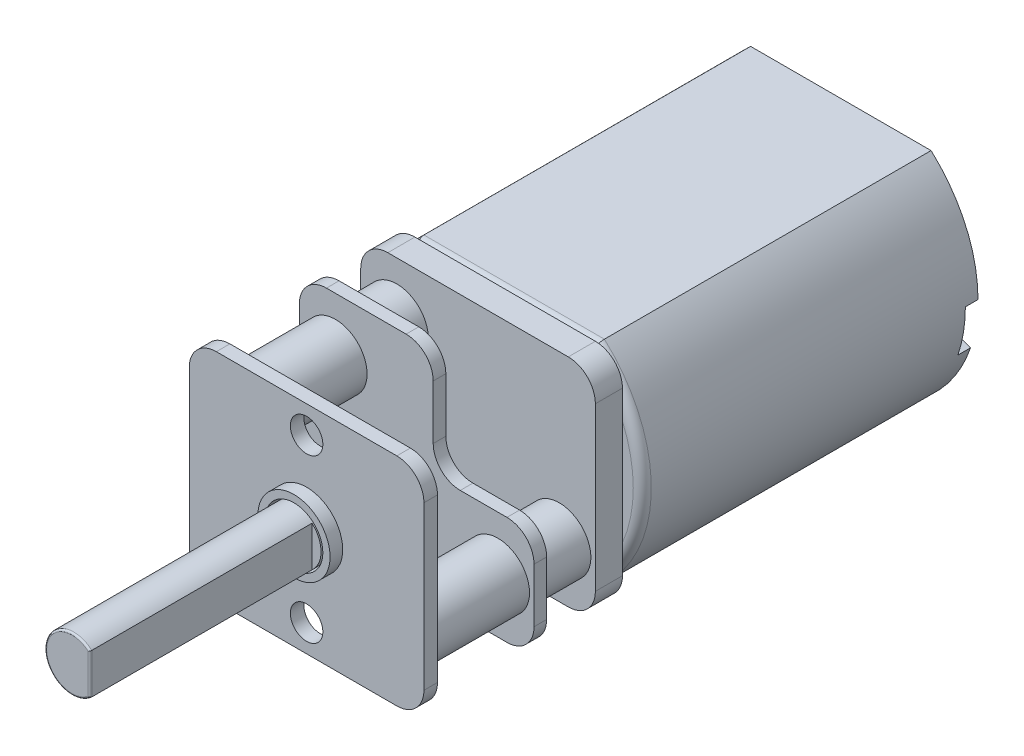
from build123d import *

# Parameters (mm, degrees)
MOTOR_DEPTH            = 18.6
SKETCH2_R              = 2.75
BOSS_EXTRUDE2_DEPTH    = 0.8
FILLET1_R              = 0.5
SKETCH3_W              = 13
SKETCH3_H              = 12
REDUCTOR_BASE_DEPTH    = 1.5
SKETCH4_R              = 1.75
REDUCTOR_SUPPORT_DEPTH = 9.5
SKETCH5_W              = 13
SKETCH5_H              = 12
REDUCTOR_CEIL_DEPTH    = 0.75
FILLET2_R              = 1.5
SKETCH6_R              = 2
SKETCH6_R_2            = 1.6
SHAFT_RING_DEPTH       = 0.7
SKETCH7_R              = 1.5
SHAFT_DEPTH            = 13
SHAFT_D_TRIM_DEPTH     = 12.3
SKETCH9_R              = 0.9
MOUNT_HOLE_DEPTH       = 0.75
CUT_EXTRUDE8_START     = -0.7
CUT_EXTRUDE8_DEPTH     = 0.7
PINS_DEPTH             = 2.5
FILLET4_R              = 0.6
FILLET5_R              = 0.1
BOSS_EXTRUDE11_DEPTH   = 0.7


with BuildPart() as part:
    # Sketch1 → Motor (new body)
    with BuildSketch(Plane.XY):
        with BuildLine():
            Line((-5, 5.85), (5, 5.85))
            ThreePointArc((5, 5.85), (7.6, 0), (5, -5.85))
            Line((5, -5.85), (-5, -5.85))
            ThreePointArc((-5, -5.85), (-7.6, 0), (-5, 5.85))
        make_face()
    extrude(amount=MOTOR_DEPTH)

    # Sketch2 → Boss-Extrude2 (add)
    with BuildSketch(Plane(origin=(0, 0, 0), x_dir=(-1, 0, 0), z_dir=(0, 0, -1))):
        Circle(SKETCH2_R)
    extrude(amount=BOSS_EXTRUDE2_DEPTH)

    # Fillet1
    fillet1_edges = [part.edges().sort_by_distance(p)[0] for p in [
        (7.6, 0, 18.6),
        (0, 5.85, 18.6),
        (-7.6, 0, 18.6),
        (0, -5.85, 18.6),
    ]]
    fillet(fillet1_edges, radius=FILLET1_R)

    # Sketch3 → reductor_base (add)
    with BuildSketch(Plane.XY.offset(18.6)):
        Rectangle(SKETCH3_W, SKETCH3_H)
    extrude(amount=REDUCTOR_BASE_DEPTH)

    # Sketch4 → reductor_support (add)
    with BuildSketch(Plane.XY.offset(20.1)):
        with Locations(Location((-4.5, 3, 0), (0, 0, 180))):
            Circle(SKETCH4_R)
        with Locations(Location((4.5, -3, 0), (0, 0, 180))):
            Circle(SKETCH4_R)
    extrude(amount=REDUCTOR_SUPPORT_DEPTH)

    # Sketch5 → reductor_ceil (add)
    with BuildSketch(Plane.XY.offset(29.6)):
        Rectangle(SKETCH5_W, SKETCH5_H)
    extrude(amount=-REDUCTOR_CEIL_DEPTH)

    # Fillet2
    fillet2_edges = [part.edges().sort_by_distance(p)[0] for p in [
        (6.5, -6, 19.35),
        (6.5, 6, 19.35),
        (-6.5, 6, 19.35),
        (-6.5, -6, 19.35),
        (-6.5, -6, 29.225),
        (-6.5, 6, 29.225),
        (6.5, 6, 29.225),
        (6.5, -6, 29.225),
    ]]
    fillet(fillet2_edges, radius=FILLET2_R)

    # Sketch6 → shaft_ring (add)
    with BuildSketch(Plane.XY.offset(29.6)):
        Circle(SKETCH6_R)
        Circle(SKETCH6_R_2, mode=Mode.SUBTRACT)
    extrude(amount=SHAFT_RING_DEPTH)

    # Sketch9 → mount_hole (cut)
    with BuildSketch(Plane.XY.offset(29.6)):
        with Locations((0, 4.5)):
            Circle(SKETCH9_R)
        with Locations((0, -4.5)):
            Circle(SKETCH9_R)
    extrude(amount=-MOUNT_HOLE_DEPTH, mode=Mode.SUBTRACT)

    # Sketch12 → Cut-Extrude8 (cut)
    with BuildSketch(Plane(origin=(0, 0, 0), x_dir=(-1, 0, 0), z_dir=(0, 0, -1)).offset(CUT_EXTRUDE8_START)):
        with BuildLine():
            ThreePointArc((-2.643071494, -0.759389938), (-2.489152604, 1.169024943), (-1.103419984, 2.518921266))
            Line((-1.103419984, 2.518921265), (-7.6, 0))
            ThreePointArc((-7.6, 0), (-7.495807414, -1.277293839), (-7.185984571, -2.520815231))
            Line((-7.185984571, -2.520815231), (-2.643071494, -0.759389938))
        make_face()
        with BuildLine():
            ThreePointArc((7.6, 0), (7.495807414, 1.277293839), (7.185984571, 2.520815231))
            Line((7.185984571, 2.520815231), (2.643071494, 0.759389938))
            ThreePointArc((2.643071494, 0.759389938), (2.723136667, 0.383440603), (2.75, 0))
            ThreePointArc((2.75, 0), (2.301836762, -1.504675222), (1.103419984, -2.518921266))
            Line((1.103419984, -2.518921265), (7.6, 0))
        make_face()
    extrude(amount=CUT_EXTRUDE8_DEPTH, mode=Mode.SUBTRACT)

    # Sketch13 → pins (add)
    with BuildSketch(Plane(origin=(0, 0, 0.7), x_dir=(-1, 0, 0), z_dir=(0, 0, -1))):
        Polygon((3.902789088, 0.999038213), (4.625804679, -0.86569996), (5.091989223, -0.684946062), (4.368973632, 1.179792111), align=None)
        Polygon((-5.111425378, 0.735074083), (-4.388409787, -1.12966409), (-3.922225244, -0.948910192), (-4.645240835, 0.915827981), align=None)
    extrude(amount=PINS_DEPTH)

    # Fillet4
    fillet4_edges = [part.edges().sort_by_distance(p)[0] for p in [
        (-4.13588136, 1.089415162, -1.8),
        (-4.858896951, -0.775323011, -1.8),
        (4.878333106, 0.825451032, -1.8),
        (4.155317515, -1.039287141, -1.8),
    ]]
    fillet(fillet4_edges, radius=FILLET4_R)

    # Sketch15 → Boss-Extrude11 (add)
    with BuildSketch(Plane.XY.offset(23.5)):
        with BuildLine():
            Line((0.914441288, 4.5), (0.914441288, 1.5))
            ThreePointArc((0.914441288, 1.5), (1.353781117, 0.439339828), (2.414441288, 0))
            Line((2.414441288, 0), (5, 0))
            ThreePointArc((5, 0), (6.060660172, -0.439339828), (6.5, -1.5))
            Line((6.5, -1.5), (6.5, -4.5))
            ThreePointArc((6.5, -4.5), (6.060660172, -5.560660172), (5, -6))
            Line((5, -6), (-5, -6))
            ThreePointArc((-5, -6), (-6.060660172, -5.560660172), (-6.5, -4.5))
            Line((-6.5, -4.5), (-6.5, 4.5))
            ThreePointArc((-6.5, 4.5), (-6.060660172, 5.560660172), (-5, 6))
            Line((-5, 6), (-0.585558712, 6))
            ThreePointArc((-0.585558712, 6), (0.47510146, 5.560660172), (0.914441288, 4.5))
        make_face()
    extrude(amount=-BOSS_EXTRUDE11_DEPTH)


with BuildPart() as body_2:
    # Sketch7 → shaft (new body)
    with BuildSketch(Plane.XY.offset(29.6)):
        Circle(SKETCH7_R)
    extrude(amount=SHAFT_DEPTH)

    # Sketch8 → shaft_D_trim (cut)
    with BuildSketch(Plane.XY.offset(42.6)):
        with BuildLine():
            Line((1, 1.118033989), (1, -1.118033989))
            ThreePointArc((1, -1.118033989), (1.5, 0), (1, 1.118033989))
        make_face()
    extrude(amount=-SHAFT_D_TRIM_DEPTH, mode=Mode.SUBTRACT)

    # Fillet5
    fillet5_edges = [body_2.edges().sort_by_distance(p)[0] for p in [
        (-1.5, 0, 42.6),
        (1, 0, 42.6),
    ]]
    fillet(fillet5_edges, radius=FILLET5_R)


solid = Compound([part.part, body_2.part])
